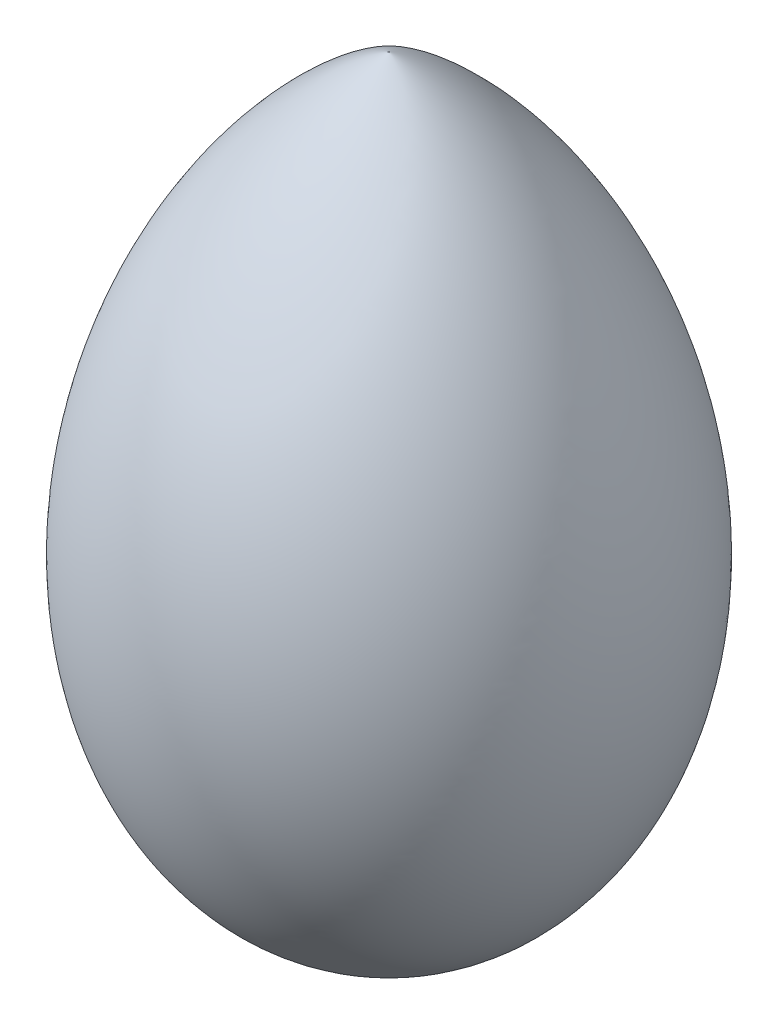
from build123d import *


with BuildPart() as part:
    # Sketch1 → Revolve1 (revolve)
    with BuildSketch(Plane.XY):
        with BuildLine():
            Line((0, -79.577471546), (0, 0))
            add(Edge.make_bspline(
                [(0, -79.577471546), (0.087680592, -79.577471546), (0.263797973, -79.576229912), (0.598650591, -79.570642551), (0.950876653, -79.555748656), (1.352625472, -79.533422124), (1.727031768, -79.503680039), (2.115309444, -79.466545155), (2.495189781, -79.422045615), (2.973326832, -79.357257557), (3.542698888, -79.264927606), (4.204604766, -79.136134134), (4.954206011, -78.960469453), (5.882741421, -78.705930541), (6.980621022, -78.34568972), (8.05511025, -77.919323385), (9.102052084, -77.430466979), (9.954602257, -76.983405598), (10.624050192, -76.60275823), (11.444493451, -76.099237964), (12.401840801, -75.452346103), (13.477279244, -74.639091976), (14.646929516, -73.636030698), (16.032484664, -72.298263256), (17.570396601, -70.571049686), (19.032827539, -68.602137848), (20.389225565, -66.396217697), (21.58243703, -64.099184568), (22.461865773, -62.078453784), (23.171399497, -60.139571977), (24.078061705, -57.195387525), (24.931218987, -53.434893309), (25.522097205, -48.450354641), (25.467149475, -42.275747963), (24.689173504, -36.151980055), (23.23776976, -30.15327669), (21.153566345, -24.344637005), (18.468657067, -18.788203828), (15.206787387, -13.548818865), (11.863552233, -9.313515337), (8.651944953, -5.997757609), (6.028210403, -3.747446055), (4.186872933, -2.368968949), (2.790989936, -1.455768974), (1.899111854, -0.927774968), (1.208914958, -0.555188095), (0.792765611, -0.345754338), (0.430888146, -0.176914066), (0.186212553, -0.071959279), (0.062329083, -0.023341488), (0, 0)],
                knots=[0.088984273, 0.088984273, 0.088984273, 0.088984273, 0.088984273, 0.092431293, 0.095878313, 0.099325333, 0.102772353, 0.106219373, 0.109666393, 0.113113413, 0.116560433, 0.123454483, 0.130348533, 0.137242583, 0.144136633, 0.157924697, 0.17171276, 0.178606823, 0.185500885, 0.192394948, 0.19928901, 0.213077085, 0.226865159, 0.240653289, 0.254441418, 0.282017662, 0.309593764, 0.328342016, 0.347090268, 0.374666473, 0.388454575, 0.402242677, 0.457395074, 0.512547465, 0.5676999, 0.622852336, 0.678004748, 0.733157135, 0.788309675, 0.843461977, 0.898614443, 0.925986448, 0.953358453, 0.967146068, 0.980933683, 0.985700262, 0.990466842, 0.995233421, 0.99761671, 1, 1, 1, 1, 1], degree=4))
        make_face()
    revolve(axis=Axis((0, -79.577471546, 0), (0, 1, 0)))


solid = part.part
